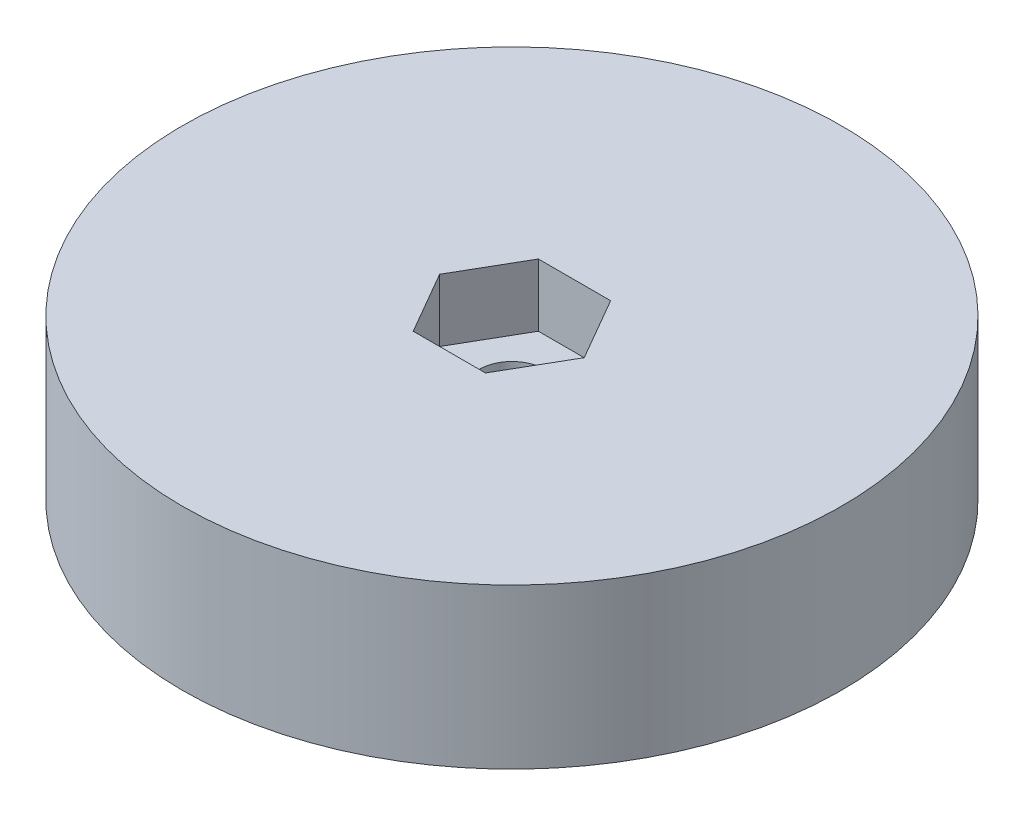
from build123d import *

# Parameters (mm, degrees)
BOSS_EXTRUDE1_DEPTH = 5.5
FILLET1_R           = 2
SKETCH2_R           = 22.114757516
BOSS_EXTRUDE2_DEPTH = 5.2
CUT_EXTRUDE1_DEPTH  = 4.2
SKETCH4_R           = 2.2
CUT_EXTRUDE2_DEPTH  = 4.2


with BuildPart() as part:
    # Sketch1 → Boss-Extrude1 (new body)
    with BuildSketch(Plane(origin=(0, 0, 0), x_dir=(1, 0, 0), z_dir=(0, 1, 0))):
        with BuildLine():
            ThreePointArc((1.5, 0), (-1.060660172, -1.060660172), (0, 1.5))
            Line((0, 1.5), (0, 22.5))
            ThreePointArc((0, 22.5), (-1.060660172, 25.060660172), (1.5, 24))
            Line((1.5, 24), (9.75, 24))
            Line((9.75, 24), (9.75, 28.5))
            Line((9.75, 28.5), (9.75, 34))
            ThreePointArc((9.75, 34), (12, -10.114757516), (14.25, 34))
            Line((14.25, 34), (14.25, 28.5))
            Line((14.25, 28.5), (14.25, 24))
            Line((14.25, 24), (22.5, 24))
            ThreePointArc((22.5, 24), (25.060660172, 25.060660172), (24, 22.5))
            Line((24, 22.5), (24, 1.5))
            ThreePointArc((24, 1.5), (25.060660172, -1.060660172), (22.5, 0))
            Line((22.5, 0), (1.5, 0))
        make_face()
        with BuildLine():
            Line((9.75, 34), (9.75, 28.5))
            Line((9.75, 28.5), (14.25, 28.5))
            Line((14.25, 28.5), (14.25, 34))
            ThreePointArc((14.25, 34), (12, 34.114757516), (9.75, 34))
        make_face()
    extrude(amount=BOSS_EXTRUDE1_DEPTH)

    # Fillet1
    fillet1_edges = [part.edges().sort_by_distance(p)[0] for p in [
        (0, 2.75, -22.5),
        (0, 2.75, -1.5),
        (1.5, 2.75, 0),
        (22.5, 2.75, 0),
        (24, 2.75, -1.5),
        (24, 2.75, -22.5),
        (22.5, 2.75, -24),
        (1.5, 2.75, -24),
    ]]
    fillet(fillet1_edges, radius=FILLET1_R)

    # Sketch2 → Boss-Extrude2 (add)
    with BuildSketch(Plane(origin=(0, 5.5, 0), x_dir=(1, 0, 0), z_dir=(0, 1, 0))):
        with Locations(Location((12, 12, 0), (0, 0, 270))):
            Circle(SKETCH2_R)
    extrude(amount=BOSS_EXTRUDE2_DEPTH)

    # Sketch3 → Cut-Extrude1 (cut)
    with BuildSketch(Plane(origin=(0, 10.7, 0), x_dir=(1, 0, 0), z_dir=(0, 1, 0))):
        Polygon((16.849742261, 12), (14.424871131, 16.2), (9.575128869, 16.2), (7.150257739, 12), (9.575128869, 7.8), (14.424871131, 7.8), align=None)
    extrude(amount=-CUT_EXTRUDE1_DEPTH, mode=Mode.SUBTRACT)

    # Sketch4 → Cut-Extrude2 (cut)
    with BuildSketch(Plane(origin=(0, 6.5, 0), x_dir=(1, 0, 0), z_dir=(0, 1, 0))):
        with Locations(Location((12, 12, 0), (0, 0, 270))):
            Circle(SKETCH4_R)
    extrude(amount=-CUT_EXTRUDE2_DEPTH, mode=Mode.SUBTRACT)


solid = part.part
